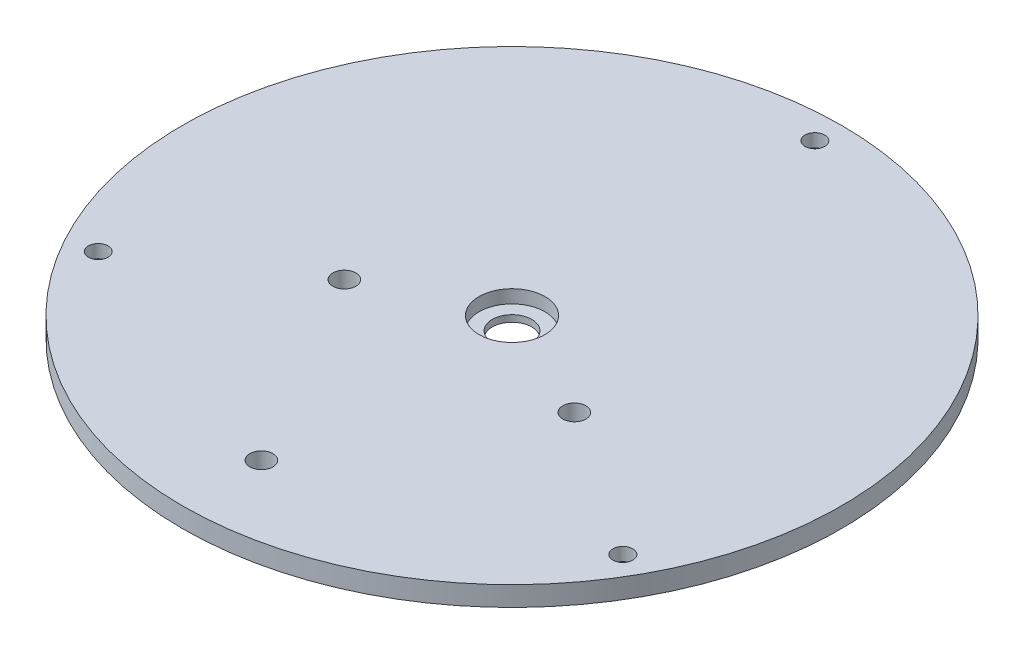
from build123d import *

# Parameters (mm, degrees)
SKETCH1_R           = 50
SKETCH1_R_2         = 3
SKETCH1_R_3         = 1.5
SKETCH1_R_4         = 1.75
BOSS_EXTRUDE1_DEPTH = 3
SKETCH2_R           = 5
CUT_EXTRUDE1_DEPTH  = 2
CHAMFER1_SIZE       = 1


with BuildPart() as part:
    # Sketch1 → Boss-Extrude1 (new body)
    with BuildSketch(Plane(origin=(0, 0, 0), x_dir=(1, 0, 0), z_dir=(0, 1, 0))):
        with Locations(Location((0, 0, 0), (0, 0, 270))):
            Circle(SKETCH1_R)
        with Locations(Location((0, 0, 0), (0, 0, 270))):
            Circle(SKETCH1_R_2, mode=Mode.SUBTRACT)
        with Locations(Location((-39.8, -22.978540714, 0), (0, 0, 270))):
            Circle(SKETCH1_R_3, mode=Mode.SUBTRACT)
        with Locations(Location((-17.45, -7.989233767, 0), (0, 0, 270))):
            Circle(SKETCH1_R_4, mode=Mode.SUBTRACT)
        with Locations(Location((0, 45.95, 0), (0, 0, 270))):
            Circle(SKETCH1_R_3, mode=Mode.SUBTRACT)
        with Locations(Location((0, -38.0178, 0), (0, 0, 270))):
            Circle(SKETCH1_R_4, mode=Mode.SUBTRACT)
        with Locations(Location((39.8, -22.978540714, 0), (0, 0, 90))):
            Circle(SKETCH1_R_3, mode=Mode.SUBTRACT)
        with Locations(Location((17.45, -7.989233767, 0), (0, 0, 90))):
            Circle(SKETCH1_R_4, mode=Mode.SUBTRACT)
    extrude(amount=BOSS_EXTRUDE1_DEPTH)

    # Sketch2 → Cut-Extrude1 (cut)
    with BuildSketch(Plane(origin=(0, 3, 0), x_dir=(1, 0, 0), z_dir=(0, 1, 0))):
        with Locations(Location((0, 0, 0), (0, 0, 270))):
            Circle(SKETCH2_R)
    extrude(amount=-CUT_EXTRUDE1_DEPTH, mode=Mode.SUBTRACT)

    # Chamfer1
    chamfer1_edges = [part.edges().sort_by_distance(p)[0] for p in [
        (0, 0, -47.45),
        (39.8, 0, 24.478540714),
        (-39.8, 0, 21.478540714),
    ]]
    chamfer(chamfer1_edges, length=CHAMFER1_SIZE)


solid = part.part
